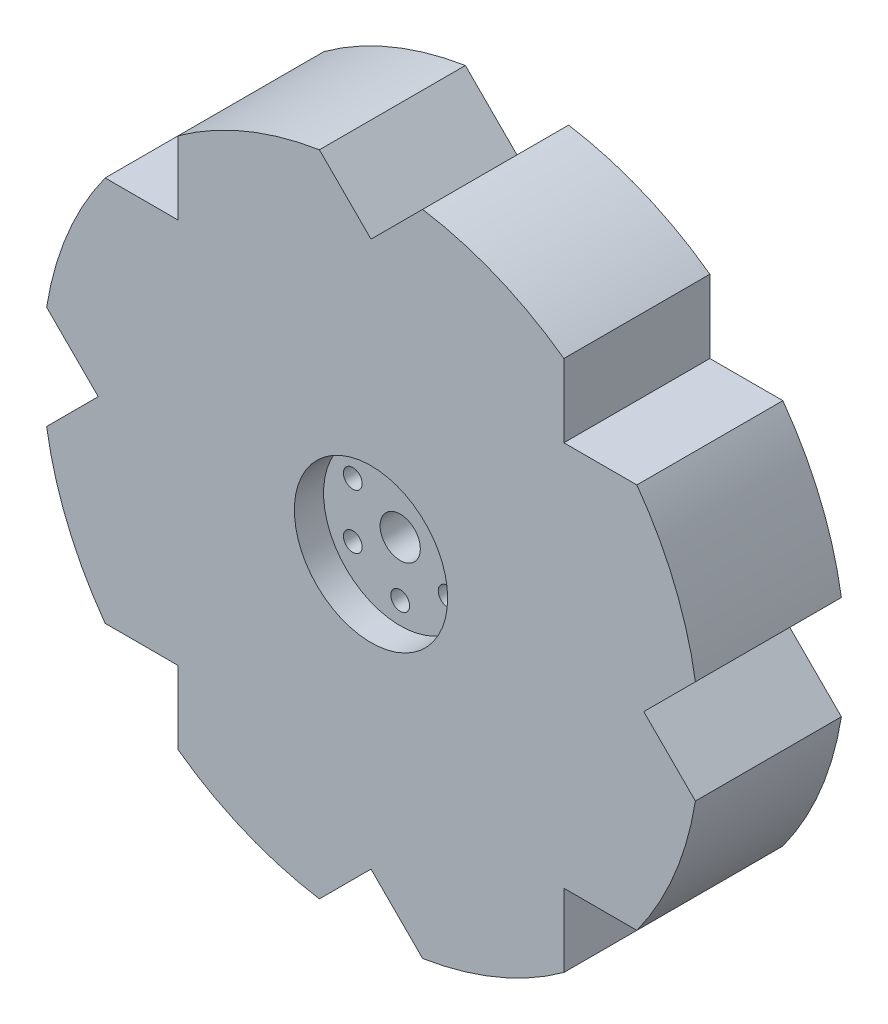
from build123d import *

# Parameters (mm, degrees)
BOSS_EXTRUDE1_DEPTH   = 25.4
SKETCH2_R             = 3.5
CUT_EXTRUDE1_DEPTH    = 84.762252835
SKETCH3_R             = 13.335
CUT_EXTRUDE2_DEPTH    = 5.08
SKETCH4_R             = 22.86
CUT_EXTRUDE3_DEPTH    = 5.08
F_4_CLEARANCE_HOLE1_D = 3.2639


with BuildPart() as part:
    # Sketch1 → Boss-Extrude1 (new body)
    with BuildSketch(Plane.XY):
        with BuildLine():
            Line((-8.980256121, 56.44003455), (0, 47.459778429))
            Line((0, 47.459778429), (8.980256121, 56.44003455))
            ThreePointArc((8.980256121, 56.44003455), (21.87035816, 52.799715283), (33.559131161, 46.259131161))
            Line((33.559131161, 46.259131161), (33.559131161, 33.559131161))
            Line((33.559131161, 33.559131161), (46.259131161, 33.559131161))
            ThreePointArc((46.259131161, 33.559131161), (52.799715283, 21.87035816), (56.44003455, 8.980256121))
            Line((56.44003455, 8.980256121), (47.459778429, 0))
            Line((47.459778429, 0), (56.44003455, -8.980256121))
            ThreePointArc((56.44003455, -8.980256121), (52.799715283, -21.87035816), (46.259131161, -33.559131161))
            Line((46.259131161, -33.559131161), (33.559131161, -33.559131161))
            Line((33.559131161, -33.559131161), (33.559131161, -46.259131161))
            ThreePointArc((33.559131161, -46.259131161), (21.87035816, -52.799715283), (8.980256121, -56.44003455))
            Line((8.980256121, -56.44003455), (0, -47.459778429))
            Line((0, -47.459778429), (-8.980256121, -56.44003455))
            ThreePointArc((-8.980256121, -56.44003455), (-21.87035816, -52.799715283), (-33.559131161, -46.259131161))
            Line((-33.559131161, -46.259131161), (-33.559131161, -33.559131161))
            Line((-33.559131161, -33.559131161), (-46.259131161, -33.559131161))
            ThreePointArc((-46.259131161, -33.559131161), (-52.799715283, -21.87035816), (-56.44003455, -8.980256121))
            Line((-56.44003455, -8.980256121), (-47.459778429, 0))
            Line((-47.459778429, 0), (-56.44003455, 8.980256121))
            ThreePointArc((-56.44003455, 8.980256121), (-52.799715283, 21.87035816), (-46.259131161, 33.559131161))
            Line((-46.259131161, 33.559131161), (-33.559131161, 33.559131161))
            Line((-33.559131161, 33.559131161), (-33.559131161, 46.259131161))
            ThreePointArc((-33.559131161, 46.259131161), (-21.87035816, 52.799715283), (-8.980256121, 56.44003455))
        make_face()
    extrude(amount=BOSS_EXTRUDE1_DEPTH)

    # Sketch2 → Cut-Extrude1 (cut, through all)
    with BuildSketch(Plane.XY.offset(25.4)):
        Circle(SKETCH2_R)
    extrude(amount=-CUT_EXTRUDE1_DEPTH, mode=Mode.SUBTRACT)

    # Sketch3 → Cut-Extrude2 (cut)
    with BuildSketch(Plane.XY.offset(25.4)):
        Circle(SKETCH3_R)
    extrude(amount=-CUT_EXTRUDE2_DEPTH, mode=Mode.SUBTRACT)

    # Sketch4 → Cut-Extrude3 (cut)
    with BuildSketch(Plane(origin=(0, 0, 0), x_dir=(-1, 0, 0), z_dir=(0, 0, -1))):
        Circle(SKETCH4_R)
    extrude(amount=-CUT_EXTRUDE3_DEPTH, mode=Mode.SUBTRACT)

    # #4 Clearance Hole1 (through all)
    with Locations(Plane(origin=(0, 0, 5.08), x_dir=(-1, 0, 0), z_dir=(0, 0, -1))):
        with Locations((0, 9.525), (8.248891971, 4.7625), (8.248891971, -4.7625), (0, -9.525), (-8.248891971, 4.7625), (-8.248891971, -4.7625)):
            Hole(F_4_CLEARANCE_HOLE1_D / 2)


solid = part.part
